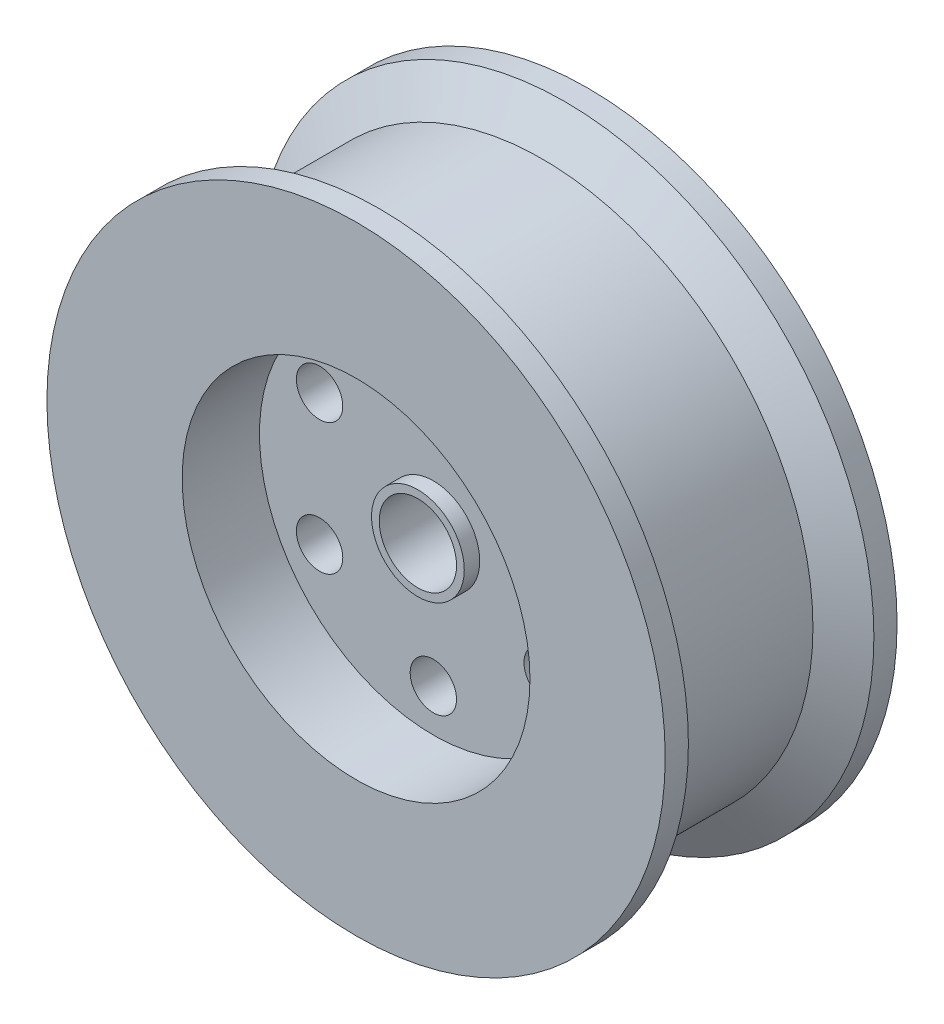
from build123d import *

# Parameters (mm, degrees)
SKETCH1_R                = 40
SKETCH1_R_2              = 5
BOSS_EXTRUDE1_DEPTH      = 15
SKETCH2_R                = 22.5
CUT_EXTRUDE2_DEPTH       = 10
SKETCH3_R                = 3
CUT_EXTRUDE8_DEPTH       = 10
CIRPATTERN1_COUNT        = 6
BOSS_EXTRUDE3_DEPTH      = 2
BOSS_EXTRUDE3_DEPTH_BACK = 7
SKETCH4_R                = 6
SKETCH4_R_2              = 5


with BuildPart() as part:
    # Sketch1 → Boss-Extrude1 (new, symmetric)
    with BuildSketch(Plane.XY):
        Circle(SKETCH1_R)
        Circle(SKETCH1_R_2, mode=Mode.SUBTRACT)
    extrude(amount=BOSS_EXTRUDE1_DEPTH, both=True)

    # Sketch2 → Cut-Extrude2 (cut)
    with BuildSketch(Plane.XY.offset(15)):
        Circle(SKETCH2_R)
    cut_extrude2 = extrude(amount=-CUT_EXTRUDE2_DEPTH, mode=Mode.SUBTRACT)

    # Mirror2: Cut-Extrude2 across plane
    add(cut_extrude2.mirror(Plane.XY), mode=Mode.SUBTRACT)

    # Sketch3 → Cut-Extrude8 (cut)
    with BuildSketch(Plane.XY.offset(5)):
        with Locations((0, 17)):
            Circle(SKETCH3_R)
    cut_extrude8 = extrude(amount=-CUT_EXTRUDE8_DEPTH, mode=Mode.SUBTRACT)

    # CirPattern1: Cut-Extrude8 ×6 about axis
    cirpattern1_axis = Axis((0, 0, 0), (0, 0, 1))
    for i in range(1, CIRPATTERN1_COUNT):
        add(cut_extrude8.rotate(cirpattern1_axis, i * 360 / CIRPATTERN1_COUNT), mode=Mode.SUBTRACT)

    # Sketch4 → Boss-Extrude3 (add, two sides: drawn at the far end of the back side and taken through both)
    with BuildSketch(Plane.XY.offset(5).offset(-BOSS_EXTRUDE3_DEPTH_BACK)):
        Circle(SKETCH4_R)
        with Locations(Location((0, 0, 0), (0, 0, 180))):
            Circle(SKETCH4_R_2, mode=Mode.SUBTRACT)
    extrude(amount=BOSS_EXTRUDE3_DEPTH + BOSS_EXTRUDE3_DEPTH_BACK)

    # Sketch5 → Cut-Revolve2 (revolve, cut)
    with BuildSketch(Plane(origin=(0, 0, 0), x_dir=(1, 0, 0), z_dir=(0, 1, 0))):
        Polygon((40, 12), (35, 9.113248654), (35, -9.113248654), (40, -12), align=None)
    revolve(axis=Axis((0, 0, 0), (0, 0, -1)), mode=Mode.SUBTRACT)


solid = part.part
